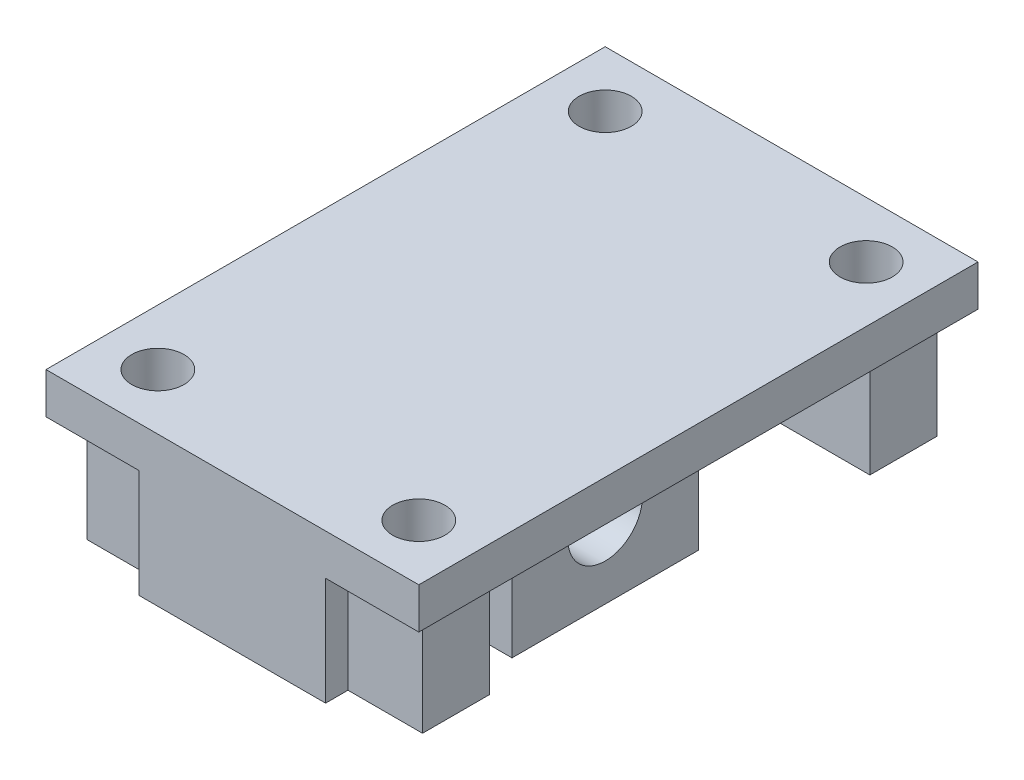
from build123d import *

# Parameters (mm, degrees)
SKETCH_1_R          = 2
EXTRUDE_1_DEPTH     = 5
SKETCH_3_W          = 30
SKETCH_3_H          = 2.196813629
EXTRUDE_2_DEPTH     = 10
SKETCH_4_R          = 1.4
CUT_EXTRUDE_2_DEPTH = 20
EXTRUDE_START       = 5.803186371
SKETCH_5_W          = 4
SKETCH_5_H          = 3.6
SKETCH_5_R          = 1.424260765
SKETCH_5_R_2        = 1.4
EXTRUDE_3_DEPTH     = 5.803186371
SKETCH_6_W          = 5.555026764
SKETCH_6_H          = 4.966415056
EXTRUDE_4_DEPTH     = 7
SKETCH_8_R          = 2.9
CUT_EXTRUDE_3_DEPTH = 5
SKETCH_9_R          = 2.2
EXTRUDE_5_DEPTH     = 5
FILLET_1_R          = 1


with BuildPart() as part:
    # 스케치1 → 보스-돌출1 (new, symmetric)
    with BuildSketch(Plane(origin=(0, 0, 0), x_dir=(0, 0, -1), z_dir=(1, 0, 0))):
        Polygon((15, 6.896813629), (-15, 6.896813629), (-15, -1.103186371), (-10.2, -1.103186371), (-10.2, 4.7), (-5, 4.7), (-5, -4), (5, -4), (5, 4.7), (10.2, 4.7), (10.2, -1.103186371), (15, -1.103186371), align=None)
        Circle(SKETCH_1_R, mode=Mode.SUBTRACT)
    extrude(amount=EXTRUDE_1_DEPTH, both=True)

    # 스케치3 → 보스-돌출2 (add, symmetric)
    with BuildSketch(Plane(origin=(0, 0, 0), x_dir=(0, 0, -1), z_dir=(1, 0, 0))):
        with Locations((0, 5.798406814)):
            Rectangle(SKETCH_3_W, SKETCH_3_H)
    extrude(amount=EXTRUDE_2_DEPTH, both=True)

    # 스케치4 → 컷-돌출2 (cut)
    with BuildSketch(Plane(origin=(0, 0, 0), x_dir=(1, 0, 0), z_dir=(0, 1, 0))):
        with Locations(Location((-7, -12, 0), (0, 0, 90))):
            Circle(SKETCH_4_R)
        with Locations(Location((7, -12, 0), (0, 0, 90))):
            Circle(SKETCH_4_R)
        with Locations(Location((7, 12, 0), (0, 0, 90))):
            Circle(SKETCH_4_R)
        with Locations(Location((-7, 12, 0), (0, 0, 90))):
            Circle(SKETCH_4_R)
    extrude(amount=CUT_EXTRUDE_2_DEPTH, mode=Mode.SUBTRACT)

    # 스케치5 → 보스-돌출3 (add)
    # profile 1 of 4: a face of its own
    with BuildSketch(Plane.XZ.offset(-4.7).offset(EXTRUDE_START)):
        with Locations((-7, -12)):
            Rectangle(SKETCH_5_W, SKETCH_5_H)
        with Locations(Location((-7, -12, 0), (0, 0, 90))):
            Circle(SKETCH_5_R, mode=Mode.SUBTRACT)
    # profile 2 of 4: a face of its own
    with BuildSketch(Plane.XZ.offset(-4.7).offset(EXTRUDE_START)):
        with Locations((7, -12)):
            Rectangle(SKETCH_5_W, SKETCH_5_H)
        with Locations(Location((7, -12, 0), (0, 0, 270))):
            Circle(SKETCH_5_R_2, mode=Mode.SUBTRACT)
    # profile 3 of 4: a face of its own
    with BuildSketch(Plane.XZ.offset(-4.7).offset(EXTRUDE_START)):
        with Locations((7, 12)):
            Rectangle(SKETCH_5_W, SKETCH_5_H)
        with Locations(Location((7, 12, 0), (0, 0, 270))):
            Circle(SKETCH_5_R_2, mode=Mode.SUBTRACT)
    # profile 4 of 4: a face of its own
    with BuildSketch(Plane.XZ.offset(-4.7).offset(EXTRUDE_START)):
        with Locations((-7, 12)):
            Rectangle(SKETCH_5_W, SKETCH_5_H)
        with Locations(Location((-7, 12, 0), (0, 0, 270))):
            Circle(SKETCH_5_R_2, mode=Mode.SUBTRACT)
    extrude(amount=-EXTRUDE_3_DEPTH)

    # 스케치6 → 보스-돌출4 (add)
    with BuildSketch(Plane.ZY.offset(5)):
        Rectangle(SKETCH_6_W, SKETCH_6_H)
    extrude(amount=-EXTRUDE_4_DEPTH)

    # 스케치8 → 컷-돌출3 (cut)
    with BuildSketch(Plane.ZY.offset(5)):
        Circle(SKETCH_8_R)
    extrude(amount=-CUT_EXTRUDE_3_DEPTH, mode=Mode.SUBTRACT)

    # 스케치9 → 보스-돌출5 (add)
    with BuildSketch(Plane.ZY):
        Circle(SKETCH_9_R)
    extrude(amount=EXTRUDE_5_DEPTH)

    # 필렛1
    fillet_1_edges = [part.edges().sort_by_distance(p)[0] for p in [
        (-5, 0, -2.2),
    ]]
    fillet(fillet_1_edges, radius=FILLET_1_R)


solid = part.part
